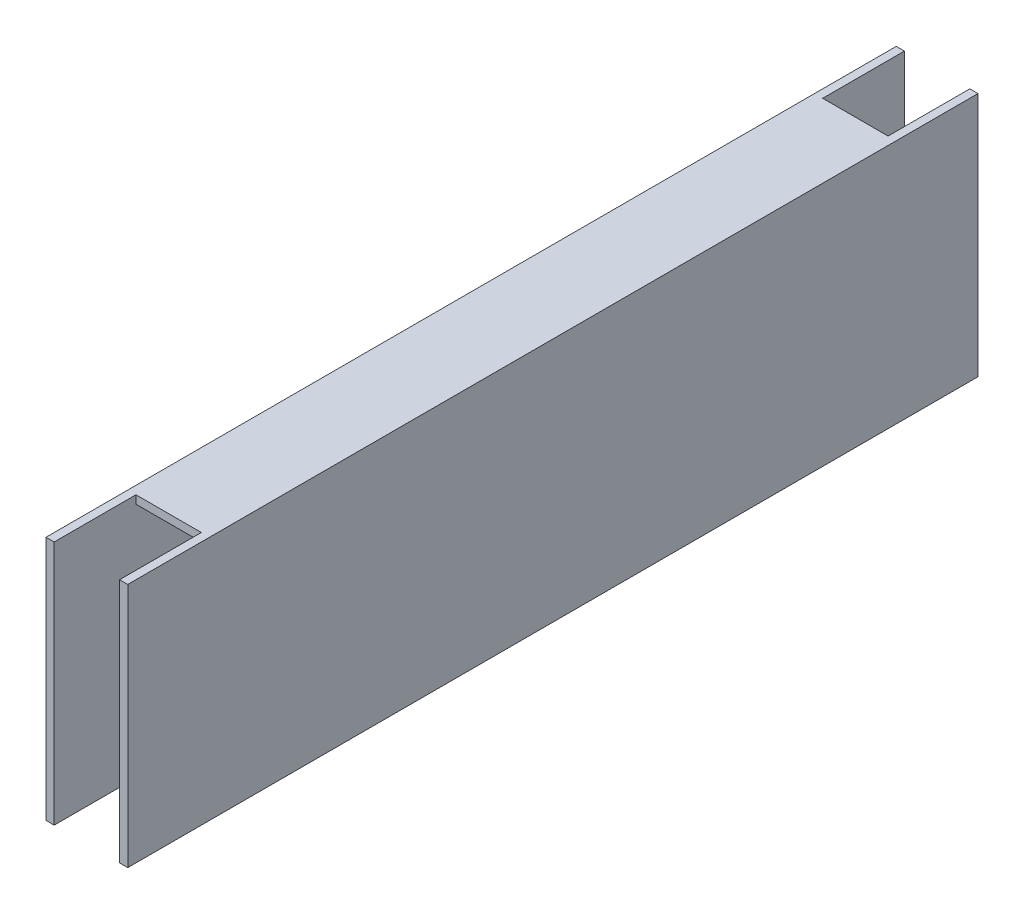
from build123d import *

# Parameters (mm, degrees)
SKETCH1_W           = 50
SKETCH1_H           = 420
BOSS_EXTRUDE1_DEPTH = 150
CUT_EXTRUDE1_DEPTH  = 447.68221366
SKETCH4_W           = 5
SKETCH4_H           = 150
BOSS_EXTRUDE2_DEPTH = 50
SKETCH5_W           = 5
SKETCH5_H           = 150
BOSS_EXTRUDE3_DEPTH = 50
SKETCH7_W           = 5
SKETCH7_H           = 150
BOSS_EXTRUDE4_DEPTH = 50
SKETCH8_W           = 5
SKETCH8_H           = 150
BOSS_EXTRUDE5_DEPTH = 50


with BuildPart() as part:
    # Sketch1 → Boss-Extrude1 (new body)
    with BuildSketch(Plane(origin=(0, 0, 0), x_dir=(1, 0, 0), z_dir=(0, 1, 0))):
        with Locations((0, 210)):
            Rectangle(SKETCH1_W, SKETCH1_H)
    extrude(amount=BOSS_EXTRUDE1_DEPTH)

    # Sketch3 → Cut-Extrude1 (cut, through all)
    with BuildSketch(Plane.XY):
        Polygon((-20, 75), (-20, 5), (20, 5), (20, 145), (-20, 145), align=None)
    extrude(amount=-CUT_EXTRUDE1_DEPTH, mode=Mode.SUBTRACT)

    # Sketch4 → Boss-Extrude2 (add)
    with BuildSketch(Plane.XY):
        with Locations((22.5, 75)):
            Rectangle(SKETCH4_W, SKETCH4_H)
    extrude(amount=BOSS_EXTRUDE2_DEPTH)

    # Sketch5 → Boss-Extrude3 (add)
    with BuildSketch(Plane.XY):
        with Locations((-22.5, 75)):
            Rectangle(SKETCH5_W, SKETCH5_H)
    extrude(amount=BOSS_EXTRUDE3_DEPTH)

    # Sketch7 → Boss-Extrude4 (add)
    with BuildSketch(Plane(origin=(0, 0, -420), x_dir=(-1, 0, 0), z_dir=(0, 0, -1))):
        with Locations((-22.5, 75)):
            Rectangle(SKETCH7_W, SKETCH7_H)
    extrude(amount=BOSS_EXTRUDE4_DEPTH)

    # Sketch8 → Boss-Extrude5 (add)
    with BuildSketch(Plane(origin=(0, 0, -420), x_dir=(-1, 0, 0), z_dir=(0, 0, -1))):
        with Locations((22.5, 75)):
            Rectangle(SKETCH8_W, SKETCH8_H)
    extrude(amount=BOSS_EXTRUDE5_DEPTH)


solid = part.part
